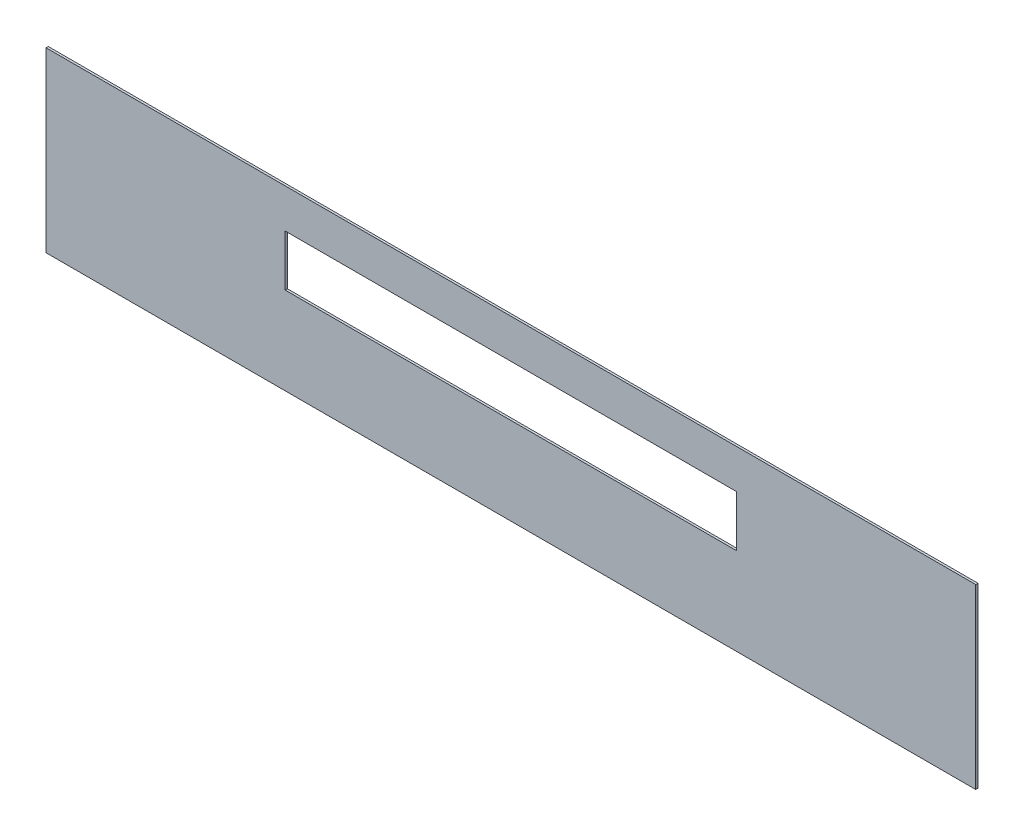
from build123d import *

# Parameters (mm, degrees)
CEK_ICECEK_ON_DIS_SAC_1_5_1_START = 38.5
SKETCH1_W                         = 618
SKETCH1_H                         = 118
CEK_ICECEK_ON_DIS_SAC_1_5_1_DEPTH = 1.5
CEK_ICECEK_ON_DIS_SAC_1_5_2_START = 27
SKETCH2_W                         = 300
SKETCH2_H                         = 34
CEK_ICECEK_ON_DIS_SAC_1_5_2_DEPTH = 14


with BuildPart() as part:
    # Sketch1 → CEK_icecek_on_dis_sac_1.5_1 (new body)
    with BuildSketch(Plane.XY.offset(CEK_ICECEK_ON_DIS_SAC_1_5_1_START)):
        with Locations((309, 59)):
            Rectangle(SKETCH1_W, SKETCH1_H)
    extrude(amount=CEK_ICECEK_ON_DIS_SAC_1_5_1_DEPTH)

    # Sketch2 → CEK_icecek_on_dis_sac_1.5_2 (cut)
    with BuildSketch(Plane.XY.offset(CEK_ICECEK_ON_DIS_SAC_1_5_2_START)):
        with Locations((309, 75)):
            Rectangle(SKETCH2_W, SKETCH2_H)
    extrude(amount=CEK_ICECEK_ON_DIS_SAC_1_5_2_DEPTH, mode=Mode.SUBTRACT)


solid = part.part
